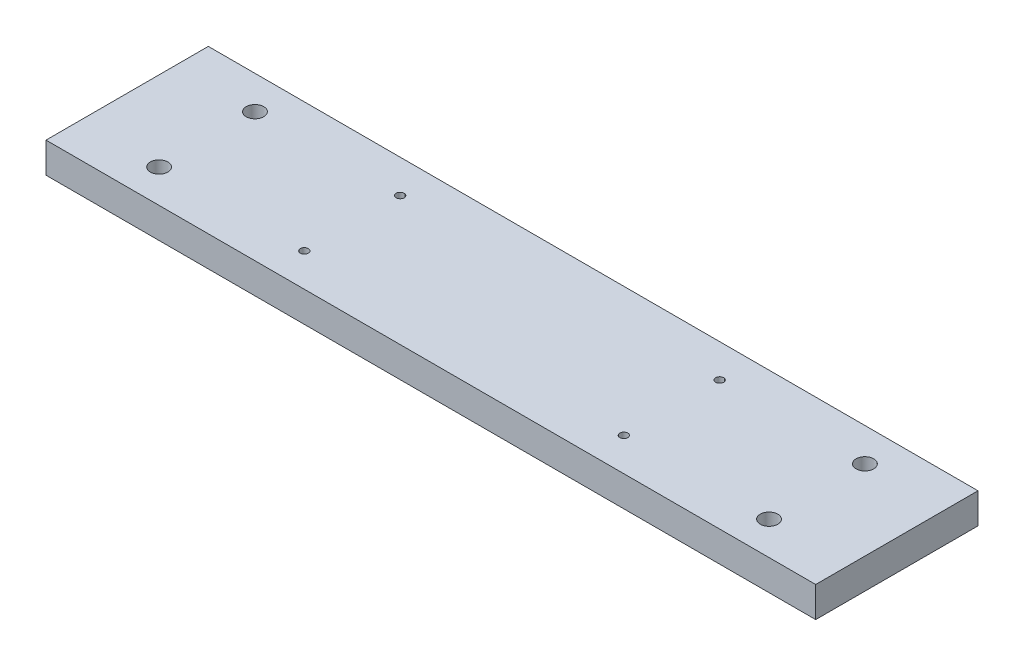
from build123d import *

# Parameters (mm, degrees)
SKETCH1_W             = 240.9
SKETCH1_H             = 50.8
BOSS_EXTRUDE1_DEPTH   = 9.525
M3X0_5_TAPPED_HOLE1_D = 2.5
M5_CLEARANCE_HOLE1_D  = 5.5


with BuildPart() as part:
    # Sketch1 → Boss-Extrude1 (new body)
    with BuildSketch(Plane(origin=(0, 0, 0), x_dir=(1, 0, 0), z_dir=(0, 1, 0))):
        Rectangle(SKETCH1_W, SKETCH1_H)
    extrude(amount=-BOSS_EXTRUDE1_DEPTH)

    # M3x0.5 Tapped Hole1 (through all)
    with Locations(Plane(origin=(0, 0, 0), x_dir=(1, 0, 0), z_dir=(0, 1, 0))):
        with Locations((-50, 15), (-50, -15), (50, -15), (50, 15)):
            Hole(M3X0_5_TAPPED_HOLE1_D / 2)

    # M5 Clearance Hole1 (through all)
    with Locations(Plane(origin=(0, 0, 0), x_dir=(1, 0, 0), z_dir=(0, 1, 0))):
        with Locations((95.45, 15), (-95.45, 15), (-95.45, -15), (95.45, -15)):
            Hole(M5_CLEARANCE_HOLE1_D / 2)


solid = part.part
